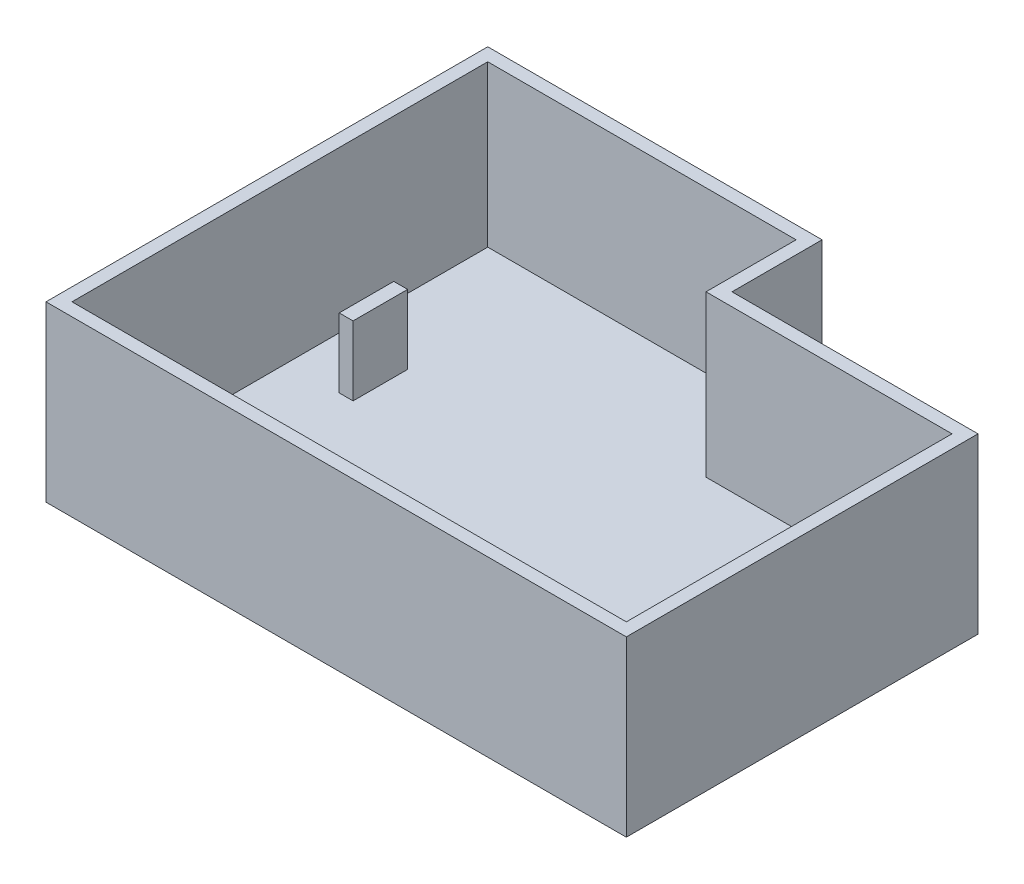
from build123d import *

# Parameters (mm, degrees)
CROQUIS1_W              = 212.725
CROQUIS1_H              = 187.325
CROQUIS1_W_2            = 203.2
CROQUIS1_H_2            = 177.8
SALIENTE_EXTRUIR1_DEPTH = 63.607999784
VACIADO1_T              = -4.7625
CROQUIS2_W              = 20
CROQUIS2_H              = 5.08
CROQUIS2_W_2            = 5.08
CROQUIS2_H_2            = 20
SALIENTE_EXTRUIR3_DEPTH = 25.4
CROQUIS2_5_W            = 5.08
CROQUIS2_5_H            = 20
CROQUIS2_5_W_2          = 20
CROQUIS2_5_H_2          = 5.08
SALIENTE_EXTRUIR4_DEPTH = 6.5
CROQUIS3_W              = 94.9325
CROQUIS3_H              = 63.1825
CORTAR_EXTRUIR1_DEPTH   = 156.343564234
SALIENTE_EXTRUIR5_DEPTH = 63.607999784
CROQUIS5_W              = 122.555
CROQUIS5_H              = 30.1625
CORTAR_EXTRUIR2_DEPTH   = 156.343564234
CROQUIS6_W              = 122.555
CROQUIS6_H              = 4.7625
SALIENTE_EXTRUIR6_DEPTH = 63.607999784
CROQUIS7_W              = 154.94
CROQUIS7_H              = 82.660152575
CORTAR_EXTRUIR3_DEPTH   = 58.845499784


with BuildPart() as part:
    # Croquis1 → Saliente-Extruir1 (new body)
    # profile 1 of 2: a face of its own
    with BuildSketch(Plane(origin=(0, 0, 0), x_dir=(1, 0, 0), z_dir=(0, 1, 0))):
        Rectangle(CROQUIS1_W, CROQUIS1_H)
        Rectangle(CROQUIS1_W_2, CROQUIS1_H_2, mode=Mode.SUBTRACT)
    # profile 2 of 2: a face of its own
    with BuildSketch(Plane(origin=(0, 0, 0), x_dir=(1, 0, 0), z_dir=(0, 1, 0))):
        Rectangle(CROQUIS1_W_2, CROQUIS1_H_2)
    extrude(amount=SALIENTE_EXTRUIR1_DEPTH)

    # Vaciado1
    vaciado1_openings = [part.faces().sort_by_distance(p)[0] for p in [
        (0, 63.607999784, 0),
    ]]
    offset(amount=VACIADO1_T, openings=vaciado1_openings, kind=Kind.INTERSECTION)

    # Croquis2 → Saliente-Extruir3 (add)
    with BuildSketch(Plane(origin=(0, 4.7625, 0), x_dir=(1, 0, 0), z_dir=(0, 1, 0))):
        with Locations((-44.45, 66.04)):
            Rectangle(CROQUIS2_W, CROQUIS2_H)
        with Locations((-80.01, 0)):
            Rectangle(CROQUIS2_W_2, CROQUIS2_H_2)
        with Locations((0, -67.31)):
            Rectangle(CROQUIS2_W, CROQUIS2_H)
        with Locations((80.01, -28.575)):
            Rectangle(CROQUIS2_W_2, CROQUIS2_H_2)
    extrude(amount=SALIENTE_EXTRUIR3_DEPTH)

    # Croquis2<5> → Saliente-Extruir4 (add)
    with BuildSketch(Plane(origin=(0, 4.7625, 0), x_dir=(1, 0, 0), z_dir=(0, 1, 0))):
        with Locations((-74.93, 0)):
            Rectangle(CROQUIS2_5_W, CROQUIS2_5_H)
        with Locations((0, -62.23)):
            Rectangle(CROQUIS2_5_W_2, CROQUIS2_5_H_2)
        with Locations((74.93, -28.575)):
            Rectangle(CROQUIS2_5_W, CROQUIS2_5_H)
    extrude(amount=SALIENTE_EXTRUIR4_DEPTH)

    # Croquis3 → Cortar-Extruir1 (cut, through all)
    with BuildSketch(Plane(origin=(0, 63.607999784, 0), x_dir=(1, 0, 0), z_dir=(0, 1, 0))):
        with Locations((58.89625, 62.07125)):
            Rectangle(CROQUIS3_W, CROQUIS3_H)
    extrude(amount=-CORTAR_EXTRUIR1_DEPTH, mode=Mode.SUBTRACT)

    # Croquis4 → Saliente-Extruir5 (add)
    with BuildSketch(Plane(origin=(0, 0, 0), x_dir=(1, 0, 0), z_dir=(0, 1, 0))):
        Polygon((11.43, 93.6625), (16.1925, 93.6625), (16.1925, 35.2425), (106.3625, 35.2425), (106.3625, 30.48), (11.43, 30.48), align=None)
    extrude(amount=SALIENTE_EXTRUIR5_DEPTH)

    # Croquis5 → Cortar-Extruir2 (cut, through all)
    with BuildSketch(Plane(origin=(0, 0, 0), x_dir=(1, 0, 0), z_dir=(0, 1, 0))):
        with Locations((-45.085, 78.58125)):
            Rectangle(CROQUIS5_W, CROQUIS5_H)
    extrude(amount=CORTAR_EXTRUIR2_DEPTH, mode=Mode.SUBTRACT)

    # Croquis6 → Saliente-Extruir6 (add)
    with BuildSketch(Plane(origin=(0, 0, 0), x_dir=(1, 0, 0), z_dir=(0, 1, 0))):
        with Locations((-45.085, 65.88125)):
            Rectangle(CROQUIS6_W, CROQUIS6_H)
    extrude(amount=SALIENTE_EXTRUIR6_DEPTH)

    # Croquis7 → Cortar-Extruir3 (cut)
    with BuildSketch(Plane(origin=(0, 63.607999784, 0), x_dir=(1, 0, 0), z_dir=(0, 1, 0))):
        with Locations((0, -23.439923713)):
            Rectangle(CROQUIS7_W, CROQUIS7_H)
    extrude(amount=-CORTAR_EXTRUIR3_DEPTH, mode=Mode.SUBTRACT)


solid = part.part
